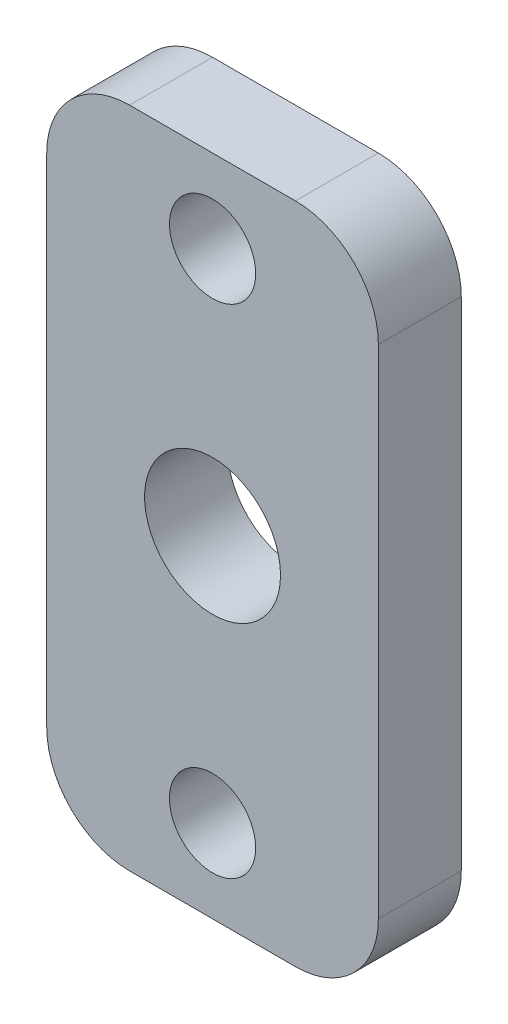
from build123d import *

# Parameters (mm, degrees)
ESBO_O1_W                = 20
ESBO_O1_H                = 40
RESSALTO_EXTRUS_O1_DEPTH = 2.5
ESBO_O2_R                = 4.1
CORTE_EXTRUS_O1_DEPTH    = 23.912878475
ESBO_O3_R                = 2.6
CORTE_EXTRUS_O2_DEPTH    = 23.912878475
FILETE1_R                = 5


with BuildPart() as part:
    # Esboço1 → Ressalto-extrusão1 (new, symmetric)
    with BuildSketch(Plane.XY):
        Rectangle(ESBO_O1_W, ESBO_O1_H)
    extrude(amount=RESSALTO_EXTRUS_O1_DEPTH, both=True)

    # Esboço2 → Corte-extrusão1 (cut, through all)
    with BuildSketch(Plane.XY.offset(2.5)):
        Circle(ESBO_O2_R)
    extrude(amount=-CORTE_EXTRUS_O1_DEPTH, mode=Mode.SUBTRACT)

    # Esboço3 → Corte-extrusão2 (cut, through all)
    with BuildSketch(Plane.XY.offset(2.5)):
        with Locations((0, 15)):
            Circle(ESBO_O3_R)
    corte_extrus_o2 = extrude(amount=-CORTE_EXTRUS_O2_DEPTH, mode=Mode.SUBTRACT)

    # Espelhar1: Corte-extrusão2 across plane
    add(corte_extrus_o2.mirror(Plane.ZX), mode=Mode.SUBTRACT)

    # Filete1
    filete1_edges = [part.edges().sort_by_distance(p)[0] for p in [
        (10, -20, 0),
        (-10, -20, 0),
        (-10, 20, 0),
        (10, 20, 0),
    ]]
    fillet(filete1_edges, radius=FILETE1_R)


solid = part.part
